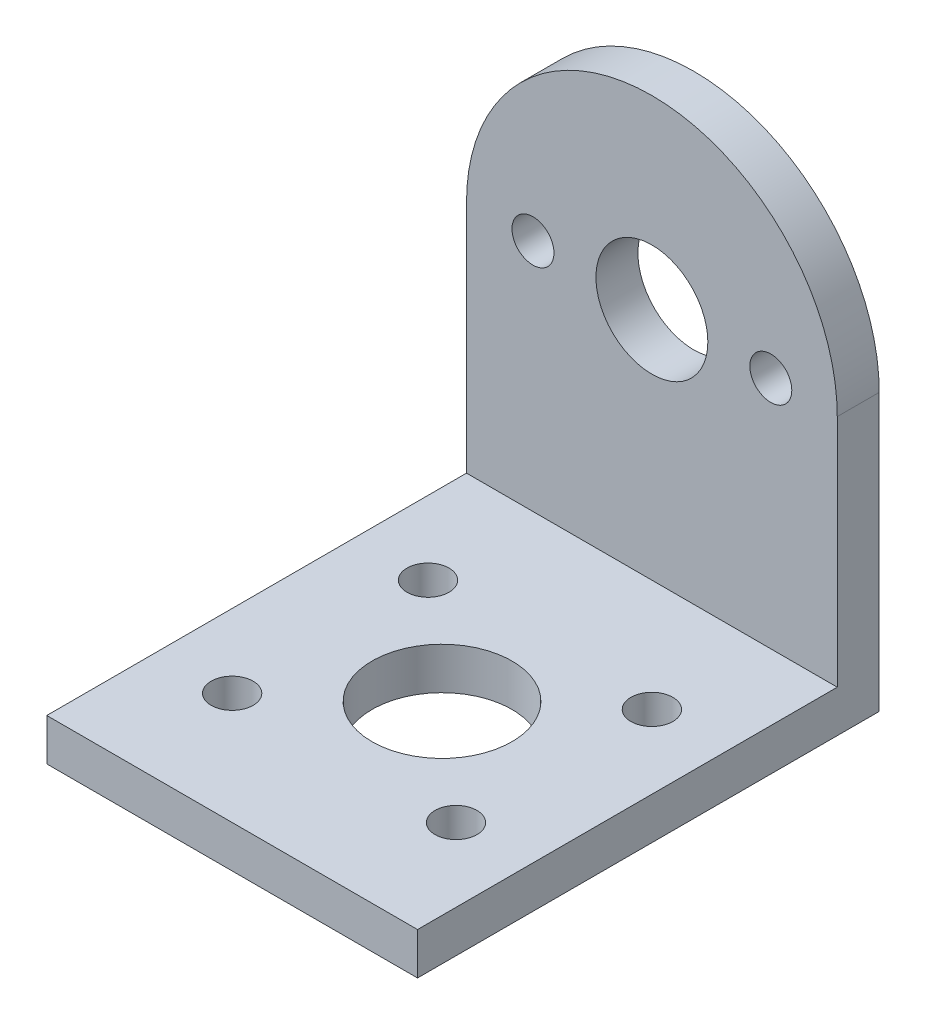
from build123d import *

# Parameters (mm, degrees)
SKETCH_1_W      = 26.5
SKETCH_1_H      = 33
SKETCH_1_R      = 5
SKETCH_1_R_2    = 1.5
EXTRUDE_1_DEPTH = 3
SKETCH_2_R      = 4
SKETCH_2_R_2    = 1.5
EXTRUDE_2_DEPTH = 3


with BuildPart() as part:
    # 草图1 → 凸台-拉伸1 (new body)
    with BuildSketch(Plane(origin=(0, 0, 0), x_dir=(1, 0, 0), z_dir=(0, 1, 0))):
        with Locations((0, -16.5)):
            Rectangle(SKETCH_1_W, SKETCH_1_H)
        with Locations(Location((0, -18, 0), (0, 0, 270))):
            Circle(SKETCH_1_R, mode=Mode.SUBTRACT)
        with Locations(Location((-8, -11, 0), (0, 0, 270))):
            Circle(SKETCH_1_R_2, mode=Mode.SUBTRACT)
        with Locations(Location((8, -11, 0), (0, 0, 270))):
            Circle(SKETCH_1_R_2, mode=Mode.SUBTRACT)
        with Locations(Location((-8, -25, 0), (0, 0, 270))):
            Circle(SKETCH_1_R_2, mode=Mode.SUBTRACT)
        with Locations(Location((8, -25, 0), (0, 0, 270))):
            Circle(SKETCH_1_R_2, mode=Mode.SUBTRACT)
    extrude(amount=EXTRUDE_1_DEPTH)

    # 草图2 → 凸台-拉伸2 (add)
    with BuildSketch(Plane.XY):
        with BuildLine():
            Line((-13.25, 3), (-13.25, 19.75))
            ThreePointArc((-13.25, 19.75), (0, 33), (13.25, 19.75))
            Line((13.25, 19.75), (13.25, 3))
            Line((13.25, 3), (-13.25, 3))
        make_face()
        with Locations((0, 19.75)):
            Circle(SKETCH_2_R, mode=Mode.SUBTRACT)
        with Locations((-8.5, 19.75)):
            Circle(SKETCH_2_R_2, mode=Mode.SUBTRACT)
        with Locations((8.5, 19.75)):
            Circle(SKETCH_2_R_2, mode=Mode.SUBTRACT)
    extrude(amount=EXTRUDE_2_DEPTH)


solid = part.part
